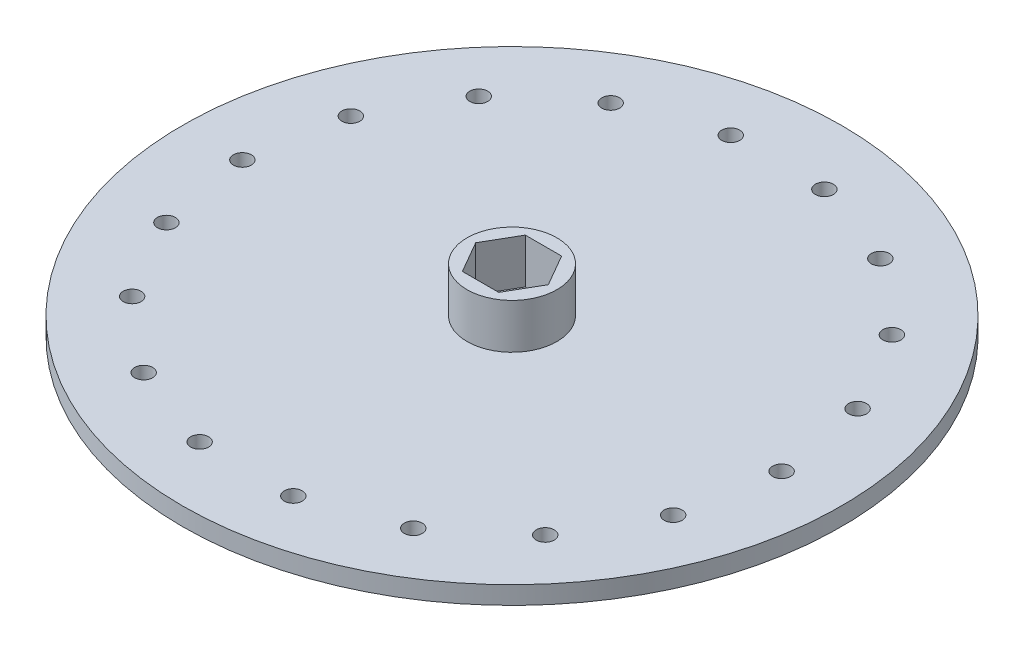
from build123d import *

# Parameters (mm, degrees)
SKETCH1_R           = 110
SKETCH1_R_2         = 3
SKETCH1_R_3         = 7.25
BOSS_EXTRUDE1_DEPTH = 6
SKETCH3_R           = 15
BOSS_EXTRUDE2_DEPTH = 15


with BuildPart() as part:
    # Sketch1 → Boss-Extrude1 (new body)
    with BuildSketch(Plane(origin=(0, 0, 0), x_dir=(1, 0, 0), z_dir=(0, 1, 0))):
        Circle(SKETCH1_R)
        with Locations((-90, 0)):
            Circle(SKETCH1_R_2, mode=Mode.SUBTRACT)
        with Locations((-84.572335871, 30.781812899)):
            Circle(SKETCH1_R_2, mode=Mode.SUBTRACT)
        with Locations((-68.943999881, 57.850884872)):
            Circle(SKETCH1_R_2, mode=Mode.SUBTRACT)
        with Locations((-45, 77.942286341)):
            Circle(SKETCH1_R_2, mode=Mode.SUBTRACT)
        with Locations((-15.62833599, 88.632697771)):
            Circle(SKETCH1_R_2, mode=Mode.SUBTRACT)
        with Locations((15.62833599, 88.632697771)):
            Circle(SKETCH1_R_2, mode=Mode.SUBTRACT)
        with Locations((45, 77.942286341)):
            Circle(SKETCH1_R_2, mode=Mode.SUBTRACT)
        with Locations((68.943999881, 57.850884872)):
            Circle(SKETCH1_R_2, mode=Mode.SUBTRACT)
        with Locations((84.572335871, 30.781812899)):
            Circle(SKETCH1_R_2, mode=Mode.SUBTRACT)
        with Locations((90, 0)):
            Circle(SKETCH1_R_2, mode=Mode.SUBTRACT)
        with Locations((84.572335871, -30.781812899)):
            Circle(SKETCH1_R_2, mode=Mode.SUBTRACT)
        with Locations((68.943999881, -57.850884872)):
            Circle(SKETCH1_R_2, mode=Mode.SUBTRACT)
        with Locations((45, -77.942286341)):
            Circle(SKETCH1_R_2, mode=Mode.SUBTRACT)
        with Locations((15.62833599, -88.632697771)):
            Circle(SKETCH1_R_2, mode=Mode.SUBTRACT)
        with Locations((-15.62833599, -88.632697771)):
            Circle(SKETCH1_R_2, mode=Mode.SUBTRACT)
        with Locations((-45, -77.942286341)):
            Circle(SKETCH1_R_2, mode=Mode.SUBTRACT)
        with Locations((-68.943999881, -57.850884872)):
            Circle(SKETCH1_R_2, mode=Mode.SUBTRACT)
        with Locations((-84.572335871, -30.781812899)):
            Circle(SKETCH1_R_2, mode=Mode.SUBTRACT)
        Circle(SKETCH1_R_3, mode=Mode.SUBTRACT)
    extrude(amount=BOSS_EXTRUDE1_DEPTH)

    # Sketch3 → Boss-Extrude2 (add)
    with BuildSketch(Plane(origin=(0, 6, 0), x_dir=(1, 0, 0), z_dir=(0, 1, 0))):
        Circle(SKETCH3_R)
        Polygon((-6.062177826, 10.5), (-12.124355653, 0), (-6.062177826, -10.5), (6.062177826, -10.5), (12.124355653, 0), (6.062177826, 10.5), align=None, mode=Mode.SUBTRACT)
    extrude(amount=BOSS_EXTRUDE2_DEPTH)


solid = part.part
